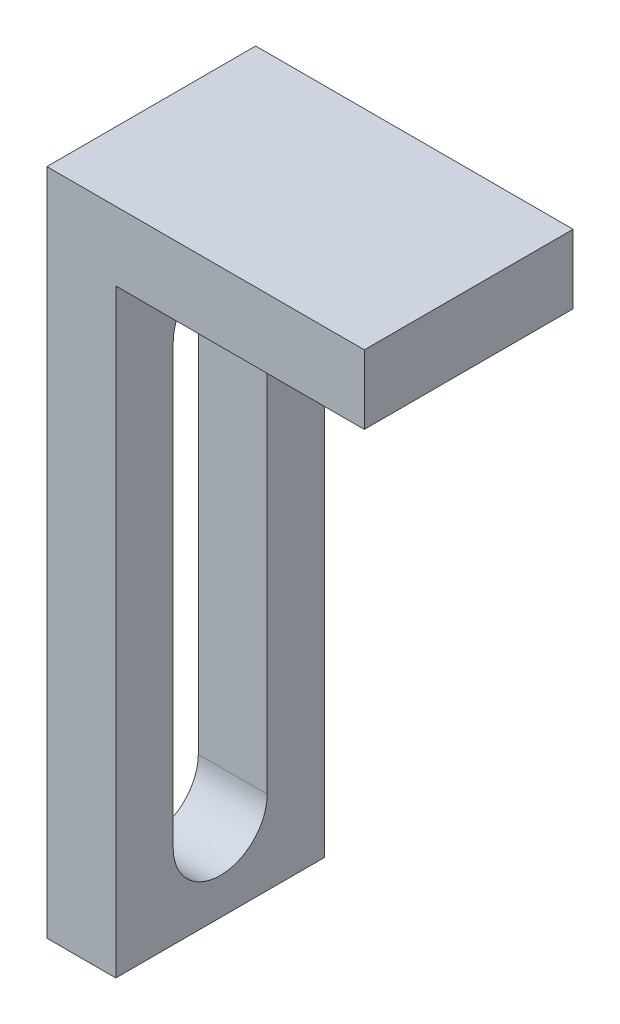
from build123d import *

# Parameters (mm, degrees)
BOSS_EXTRUDE1_DEPTH = 10
CUT_EXTRUDE1_DEPTH  = 6


with BuildPart() as part:
    # Sketch1 → Boss-Extrude1 (new body)
    with BuildSketch(Plane.XY):
        Polygon((-10.305084746, -21.694915254), (-7.005084746, -21.694915254), (-7.005084746, 7.005084746), (4.894915254, 7.005084746), (4.894915254, 10.305084746), (-10.305084746, 10.305084746), align=None)
    extrude(amount=BOSS_EXTRUDE1_DEPTH)

    # Sketch2 → Cut-Extrude1 (cut)
    with BuildSketch(Plane.ZY.offset(10.305084746)):
        with BuildLine():
            Line((2.75, 3.305084746), (2.75, -17.694915254))
            ThreePointArc((2.75, -17.694915254), (5, -19.944915254), (7.25, -17.694915254))
            Line((7.25, -17.694915254), (7.25, 3.305084746))
            ThreePointArc((7.25, 3.305084746), (5, 5.555084746), (2.75, 3.305084746))
        make_face()
    extrude(amount=-CUT_EXTRUDE1_DEPTH, mode=Mode.SUBTRACT)


solid = part.part
